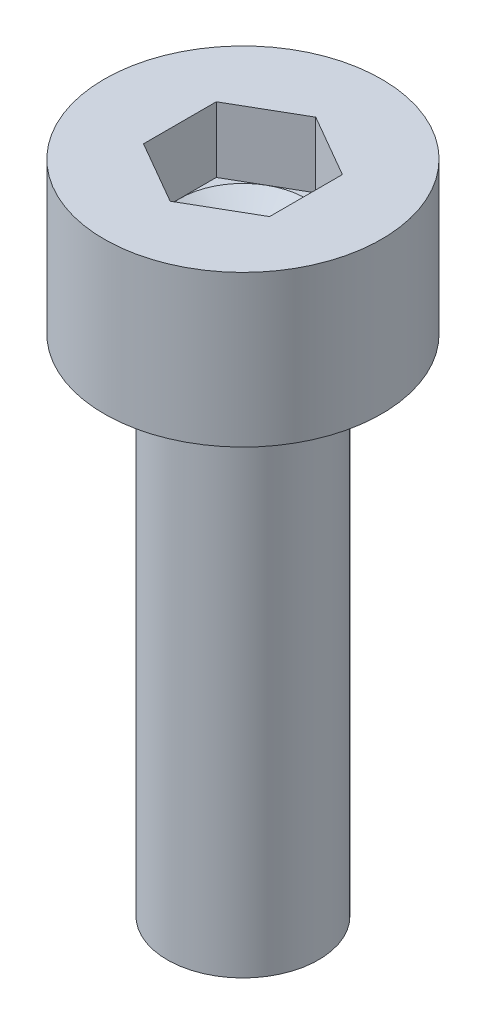
from build123d import *

# Parameters (mm, degrees)
CUT_EXTRUDE1_DEPTH = 1.3


with BuildPart() as part:
    # Sketch1 → Revolve1 (revolve)
    with BuildSketch(Plane.XY, mode=Mode.PRIVATE) as revolve1_sk:
        Polygon((0, 0), (2.75, 0), (2.75, -3), (1.5, -3), (1.5, -13), (0, -13), align=None)
    revolve(revolve1_sk.sketch.rotate(Axis((0, 0, 0), (0, -1, 0)), 180), axis=Axis((0, 0, 0), (0, -1, 0)))

    # Sketch2 → Cut-Revolve1 (revolve, cut)
    with BuildSketch(Plane.XY, mode=Mode.PRIVATE) as cut_revolve1_sk:
        Polygon((1.25, 0), (1.25, -1.3), (0, -2.021687836), (0, 0), align=None)
    revolve(cut_revolve1_sk.sketch.rotate(Axis((0, 0, 0), (0, -1, 0)), 90), axis=Axis((0, 0, 0), (0, -1, 0)), mode=Mode.SUBTRACT)

    # Sketch3 → Cut-Extrude1 (cut)
    with BuildSketch(Plane(origin=(0, 0, 0), x_dir=(1, 0, 0), z_dir=(0, 1, 0))):
        Polygon((0, 1.443375673), (-1.25, 0.721687836), (-1.25, -0.721687836), (0, -1.443375673), (1.25, -0.721687836), (1.25, 0.721687836), align=None)
    extrude(amount=-CUT_EXTRUDE1_DEPTH, mode=Mode.SUBTRACT)


solid = part.part
